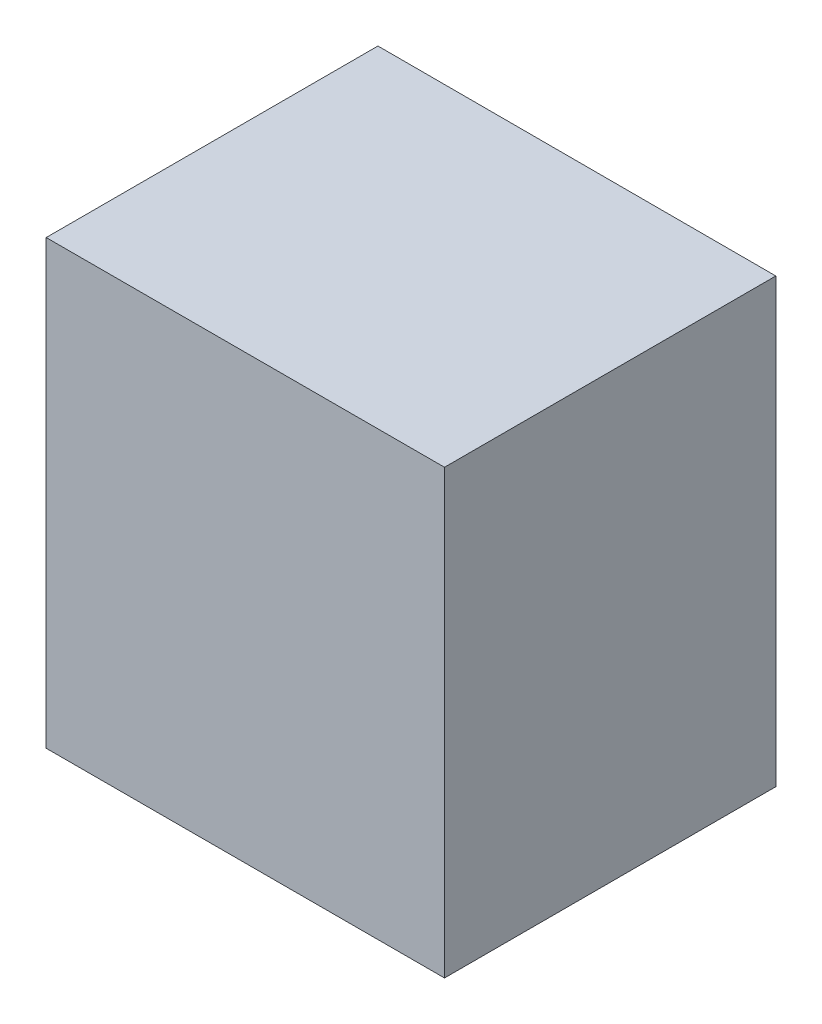
from build123d import *

# Parameters (mm, degrees)
BOSS_EXTRUDE1_DEPTH  = 1016
SKETCH2_W            = 834.909944441
SKETCH2_H            = 965.348785231
CUT_EXTRUDE1_DEPTH   = 723.9
SKETCH3_R            = 38.1
BOSS_EXTRUDE2_DEPTH  = 723.9
SKETCH4_R            = 21.824467542
BOSS_EXTRUDE3_DEPTH  = 3.556
LPATTERN4_COUNT      = 7
LPATTERN4_PITCH      = 114.3
LPATTERN4_COUNT_DIR2 = 9
LPATTERN4_PITCH_DIR2 = 104.14


with BuildPart() as part:
    # Sketch1 → Boss-Extrude1 (new body)
    with BuildSketch(Plane(origin=(0, 0, 0), x_dir=(1, 0, 0), z_dir=(0, 1, 0))):
        Polygon((-457.2, -381), (-457.2, 381), (457.2, 380.492), (457.2, -380.492), align=None)
    extrude(amount=BOSS_EXTRUDE1_DEPTH)

    # Sketch2 → Cut-Extrude1 (cut)
    with BuildSketch(Plane(origin=(0.21152549, 0, -380.745882486), x_dir=(-0.9999998456790481, 0, -0.0005555554698215814), z_dir=(0.0005555554698215814, 0, -0.9999998456790481))):
        with Locations((0.106508893, 511.58382344)):
            Rectangle(SKETCH2_W, SKETCH2_H)
    extrude(amount=-CUT_EXTRUDE1_DEPTH, mode=Mode.SUBTRACT)

    # Sketch3 → Boss-Extrude2 (add)
    with BuildSketch(Plane(origin=(-0.190641114, 0, 343.154005801), x_dir=(-0.9999998456790481, 0, -0.0005555554698216001), z_dir=(0.0005555554698216001, 0, -0.9999998456790481))):
        with Locations((-351.253434757, 946.469423659)):
            Circle(SKETCH3_R)
    boss_extrude2 = extrude(amount=BOSS_EXTRUDE2_DEPTH)

    # Sketch4 → Boss-Extrude3 (add)
    with BuildSketch(Plane(origin=(0.21152549, 0, -380.745882486), x_dir=(-0.9999998456790481, 0, -0.0005555554698216001), z_dir=(0.0005555554698216001, 0, -0.9999998456790481))):
        with Locations((-354.287460121, 946.233273052)):
            Circle(SKETCH4_R)
    boss_extrude3 = extrude(amount=BOSS_EXTRUDE3_DEPTH)

    # LPattern4: Boss-Extrude2, Boss-Extrude3 7 × 9
    with Locations(*[Vector(-0.9999998456790481, 0, -0.0005555554698216149) * (i * LPATTERN4_PITCH) + Vector(0, -1, 0) * (j * LPATTERN4_PITCH_DIR2) for i in range(LPATTERN4_COUNT) for j in range(LPATTERN4_COUNT_DIR2) if (i, j) != (0, 0)]):
        add(boss_extrude2)
        add(boss_extrude3)


solid = part.part
